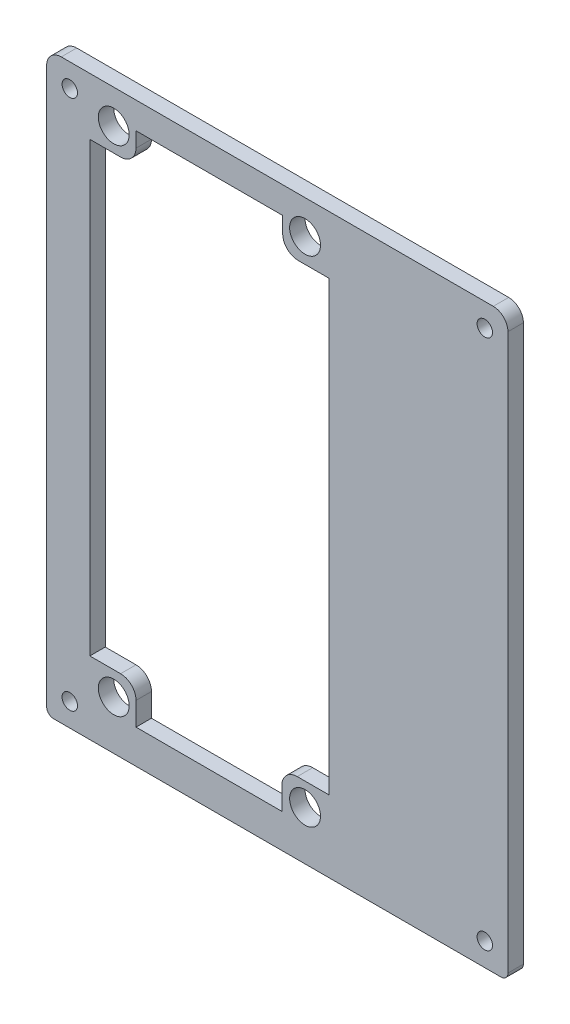
from build123d import *

# Parameters (mm, degrees)
SKETCH_2_R          = 1
EXTRUDE_1_DEPTH     = 2
SKETCH_4_R          = 2
CUT_EXTRUDE_1_DEPTH = 3


with BuildPart() as part:
    # 草图2 → 凸台-拉伸1 (new body)
    with BuildSketch(Plane.XY):
        with BuildLine():
            Line((-56.473572366, -0.89607242), (1.526427634, -0.89607242))
            ThreePointArc((1.526427634, -0.89607242), (2.162823737, -0.632468523), (2.426427634, 0.00392758))
            Line((2.426427634, 0.00392758), (2.426427634, 72.00392758))
            ThreePointArc((2.426427634, 72.00392758), (1.869930519, 73.347430464), (0.526427634, 73.90392758))
            Line((0.526427634, 73.90392758), (-55.473572366, 73.90392758))
            ThreePointArc((-55.473572366, 73.90392758), (-56.81707525, 73.347430464), (-57.373572366, 72.00392758))
            Line((-57.373572366, 72.00392758), (-57.373572366, 0.00392758))
            ThreePointArc((-57.373572366, 0.00392758), (-57.109968469, -0.632468523), (-56.473572366, -0.89607242))
        make_face()
        with Locations((-54.373572366, 70.90392758)):
            Circle(SKETCH_2_R, mode=Mode.SUBTRACT)
        with Locations((-0.573572366, 70.90392758)):
            Circle(SKETCH_2_R, mode=Mode.SUBTRACT)
        with Locations((-0.573572366, 2.10392758)):
            Circle(SKETCH_2_R, mode=Mode.SUBTRACT)
        with Locations((-54.373572366, 2.10392758)):
            Circle(SKETCH_2_R, mode=Mode.SUBTRACT)
    extrude(amount=EXTRUDE_1_DEPTH)

    # 草图4 → 切除-拉伸1 (cut)
    with BuildSketch(Plane.XY):
        with BuildLine():
            Line((-51.773572366, 66.50392758), (-51.773572366, 8.50392758))
            Line((-51.773572366, 8.50392758), (-47.786382689, 8.50392758))
            ThreePointArc((-47.786382689, 8.50392758), (-46.372169126, 7.918141142), (-45.786382689, 6.50392758))
            Line((-45.786382689, 6.50392758), (-45.786382689, 3.50392758))
            Line((-45.786382689, 3.50392758), (-26.886382689, 3.50392758))
            Line((-26.886382689, 3.50392758), (-26.886382689, 6.40392758))
            ThreePointArc((-26.886382689, 6.40392758), (-26.300596251, 7.818141142), (-24.886382689, 8.40392758))
            Line((-24.886382689, 8.40392758), (-20.773572366, 8.40392758))
            Line((-20.773572366, 8.40392758), (-20.773572366, 66.40392758))
            Line((-20.773572366, 66.40392758), (-24.773572366, 66.40392758))
            ThreePointArc((-24.773572366, 66.40392758), (-26.187785928, 66.989714017), (-26.773572366, 68.40392758))
            Line((-26.773572366, 68.40392758), (-26.773572366, 70.45392758))
            Line((-26.773572366, 70.45392758), (-45.786382689, 70.45392758))
            Line((-45.786382689, 70.45392758), (-45.786382689, 68.50392758))
            ThreePointArc((-45.786382689, 68.50392758), (-46.372169126, 67.089714017), (-47.786382689, 66.50392758))
            Line((-47.786382689, 66.50392758), (-51.773572366, 66.50392758))
        make_face()
        with Locations(Location((-23.873572366, 69.55392758, 0), (0, 0, 180))):
            Circle(SKETCH_4_R)
        with Locations(Location((-48.673572366, 69.55392758, 0), (0, 0, 180))):
            Circle(SKETCH_4_R)
        with Locations(Location((-48.673572366, 5.45392758, 0), (0, 0, 180))):
            Circle(SKETCH_4_R)
        with Locations(Location((-23.873572366, 5.45392758, 0), (0, 0, 180))):
            Circle(SKETCH_4_R)
    extrude(amount=CUT_EXTRUDE_1_DEPTH, mode=Mode.SUBTRACT)


solid = part.part
